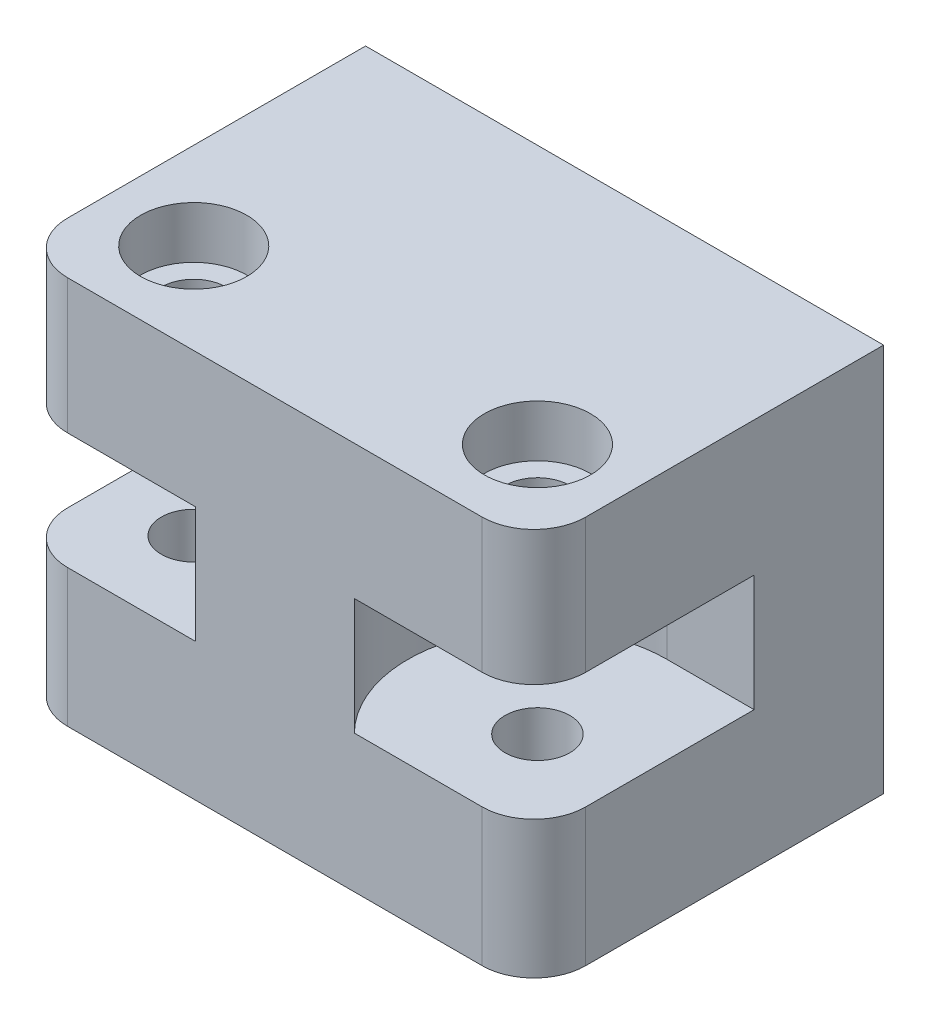
from build123d import *

# Parameters (mm, degrees)
SKETCH1_W           = 40
SKETCH1_H           = 27
BOSS_EXTRUDE1_DEPTH = 30
CUT_EXTRUDE1_DEPTH  = 10
SKETCH3_R           = 2.5
CUT_EXTRUDE2_DEPTH  = 30
CUT_EXTRUDE5_START  = -10.62
CUT_EXTRUDE5_DEPTH  = 9
SKETCH10_W          = 20
SKETCH10_H          = 9
CUT_EXTRUDE7_DEPTH  = 6.8
SKETCH12_W          = 20
SKETCH12_H          = 9
CUT_EXTRUDE10_DEPTH = 6.8
FILLET1_R           = 4
SKETCH15_R          = 4.1
CUT_EXTRUDE12_DEPTH = 4
SKETCH16_R          = 2.5
CUT_EXTRUDE13_DEPTH = 4


with BuildPart() as part:
    # Sketch1 → Boss-Extrude1 (new body)
    with BuildSketch(Plane(origin=(0, 0, 0), x_dir=(1, 0, 0), z_dir=(0, 1, 0))):
        with Locations((-2.846153846, 4.313186813)):
            Rectangle(SKETCH1_W, SKETCH1_H)
    extrude(amount=BOSS_EXTRUDE1_DEPTH)

    # Sketch2 → Cut-Extrude1 (cut)
    with BuildSketch(Plane(origin=(0, 0, -17.813186813), x_dir=(-1, 0, 0), z_dir=(0, 0, -1))):
        Polygon((-8.086431081, 26), (-8.086431081, 4), (-0.206431081, 4), (-0.206431081, 7), (-2.866431081, 7), (-2.866431081, 8.008707537), (-0.253846154, 10.628707537), (5.946153846, 10.628707537), (8.558738773, 8.008707537), (8.558738773, 7), (5.898738773, 7), (5.898738773, 4), (13.778738773, 4), (13.778738773, 26), (5.898738773, 26), (5.898738773, 23), (8.558738773, 23), (8.558738773, 21.991292463), (5.938738773, 19.378707537), (-0.246431081, 19.378707537), (-2.866431081, 21.991292463), (-2.866431081, 23), (-0.206431081, 23), (-0.206431081, 26), align=None)
    extrude(amount=-CUT_EXTRUDE1_DEPTH, mode=Mode.SUBTRACT)

    # Sketch3 → Cut-Extrude2 (cut)
    with BuildSketch(Plane.XZ):
        with Locations((10.423846154, 2.186813187)):
            Circle(SKETCH3_R)
        with Locations((-16.116153846, 2.186813187)):
            Circle(SKETCH3_R)
    extrude(amount=-CUT_EXTRUDE2_DEPTH, mode=Mode.SUBTRACT)

    # Sketch8 → Cut-Extrude5 (cut)
    with BuildSketch(Plane.XZ.offset(CUT_EXTRUDE5_START)):
        with BuildLine():
            Line((17.153846154, 9.186813187), (3.282417725, 9.186813187))
            ThreePointArc((3.282417725, 9.186813187), (1.204301697, -1.686170159), (10.423846154, -7.813186813))
            Line((10.423846154, -7.813186813), (17.153846154, -7.813186813))
            Line((17.153846154, -7.813186813), (17.153846154, 9.186813187))
        make_face()
        with BuildLine():
            ThreePointArc((-16.116153846, -7.813186813), (-6.896609389, -1.686170159), (-8.974725418, 9.186813187))
            Line((-8.974725418, 9.186813187), (-22.846153846, 9.186813187))
            Line((-22.846153846, 9.186813187), (-22.846153846, -7.813186813))
            Line((-22.846153846, -7.813186813), (-16.116153846, -7.813186813))
        make_face()
    extrude(amount=-CUT_EXTRUDE5_DEPTH, mode=Mode.SUBTRACT)

    # Sketch10 → Cut-Extrude7 (cut)
    with BuildSketch(Plane.ZY.offset(-8.086431081)):
        with Locations((-7.813186813, 15.12)):
            Rectangle(SKETCH10_W, SKETCH10_H)
    extrude(amount=CUT_EXTRUDE7_DEPTH, mode=Mode.SUBTRACT)

    # Sketch12 → Cut-Extrude10 (cut)
    with BuildSketch(Plane(origin=(-13.778738773, 0, 0), x_dir=(0, 0, -1), z_dir=(1, 0, 0))):
        with Locations((7.813186813, 15.12)):
            Rectangle(SKETCH12_W, SKETCH12_H)
    extrude(amount=CUT_EXTRUDE10_DEPTH, mode=Mode.SUBTRACT)

    # Fillet1
    fillet1_edges = [part.edges().sort_by_distance(p)[0] for p in [
        (17.153846154, 5.31, 9.186813187),
        (17.153846154, 24.81, 9.186813187),
        (-22.846153846, 5.31, 9.186813187),
        (-22.846153846, 24.81, 9.186813187),
    ]]
    fillet(fillet1_edges, radius=FILLET1_R)

    # Sketch15 → Cut-Extrude12 (cut)
    with BuildSketch(Plane(origin=(0, 30, 0), x_dir=(1, 0, 0), z_dir=(0, 1, 0))):
        with Locations((-16.116153846, -2.186813187)):
            Circle(SKETCH15_R)
        with Locations((10.423846154, -2.186813187)):
            Circle(SKETCH15_R)
    extrude(amount=-CUT_EXTRUDE12_DEPTH, mode=Mode.SUBTRACT)

    # Sketch16 → Cut-Extrude13 (cut)
    # profile 1 of 2: a face of its own
    with BuildSketch(Plane.XZ):
        Polygon((-13.749017742, -1.913186813), (-11.381881639, 2.186813187), (-13.749017742, 6.286813187), (-18.48328995, 6.286813187), (-20.850426054, 2.186813187), (-18.48328995, -1.913186813), align=None)
        with Locations((-16.116153846, 2.186813187)):
            Circle(SKETCH16_R, mode=Mode.SUBTRACT)
    # profile 2 of 2: a face of its own
    with BuildSketch(Plane.XZ):
        Polygon((12.790982258, -1.913186813), (15.158118361, 2.186813187), (12.790982258, 6.286813187), (8.05671005, 6.286813187), (5.689573946, 2.186813187), (8.05671005, -1.913186813), align=None)
        with Locations((10.423846154, 2.186813187)):
            Circle(SKETCH16_R, mode=Mode.SUBTRACT)
    extrude(amount=-CUT_EXTRUDE13_DEPTH, mode=Mode.SUBTRACT)


solid = part.part
